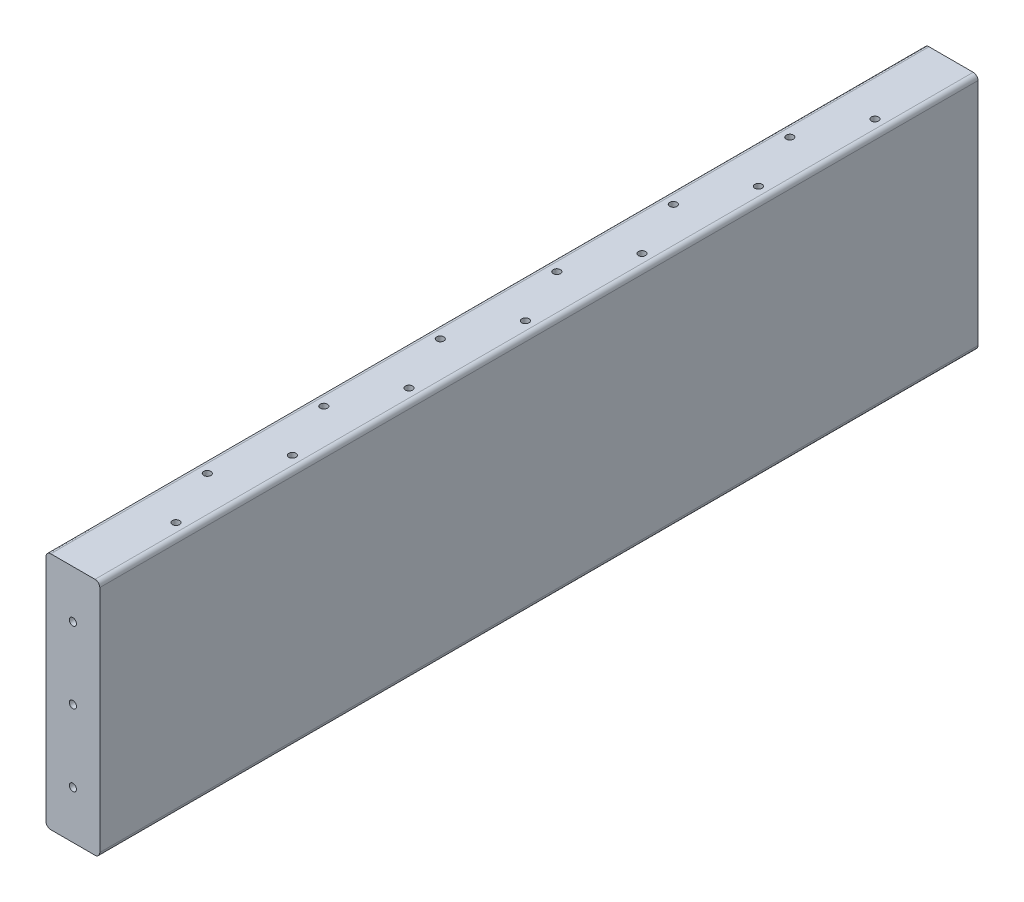
from build123d import *

# Parameters (mm, degrees)
SKETCH1_W                       = 45
SKETCH1_H                       = 200
BOSS_EXTRUDE1_DEPTH             = 735
FILLET1_R                       = 4
F_6_0MM_DOWEL_SLOT1_D           = 6
F_6_0MM_DOWEL_SLOT1_DEPTH       = 63.197418143
F_6_0MM_DOWEL_SLOT1_CSINK_D     = 6.05
F_6_0MM_DOWEL_SLOT1_CSINK_ANGLE = 90
F_6_0MM_DOWEL_SLOT1_TIP         = 1.802581857
F_6_0MM_DOWEL_SLOT2_D           = 6
F_6_0MM_DOWEL_SLOT2_DEPTH       = 63.197418143
F_6_0MM_DOWEL_SLOT2_CSINK_D     = 6.05
F_6_0MM_DOWEL_SLOT2_CSINK_ANGLE = 90
F_6_0MM_DOWEL_SLOT2_TIP         = 1.802581857
F_6_0MM_DOWEL_SLOT6_D           = 6
F_6_0MM_DOWEL_SLOT6_DEPTH       = 28.197418143
F_6_0MM_DOWEL_SLOT6_CSINK_D     = 6.05
F_6_0MM_DOWEL_SLOT6_CSINK_ANGLE = 90
F_6_0MM_DOWEL_SLOT6_TIP         = 1.802581857


with BuildPart() as part:
    # Sketch1 → Boss-Extrude1 (new body)
    with BuildSketch(Plane.XY):
        with Locations((-8.688255411, 34.272684877)):
            Rectangle(SKETCH1_W, SKETCH1_H)
    extrude(amount=BOSS_EXTRUDE1_DEPTH)

    # Fillet1
    fillet1_edges = [part.edges().sort_by_distance(p)[0] for p in [
        (13.811744589, 134.272684877, 367.5),
        (13.811744589, -65.727315123, 367.5),
        (-31.188255411, -65.727315123, 367.5),
        (-31.188255411, 134.272684877, 367.5),
    ]]
    fillet(fillet1_edges, radius=FILLET1_R)

    # Ø6.0mm Dowel Slot1
    with Locations(Plane(origin=(863.811744589, -65.727315123, 780), x_dir=(1, 0, 0), z_dir=(0, 0, 1))):
        with Locations((-872.5, 160), (-872.5, 100), (-872.5, 40)):
            CounterSinkHole(F_6_0MM_DOWEL_SLOT1_D / 2, F_6_0MM_DOWEL_SLOT1_CSINK_D / 2, depth=F_6_0MM_DOWEL_SLOT1_DEPTH, counter_sink_angle=F_6_0MM_DOWEL_SLOT1_CSINK_ANGLE)
            with Locations((0, 0, -(F_6_0MM_DOWEL_SLOT1_DEPTH + F_6_0MM_DOWEL_SLOT1_TIP / 2))):  # 118° drill point
                Cone(0, F_6_0MM_DOWEL_SLOT1_D / 2, F_6_0MM_DOWEL_SLOT1_TIP, mode=Mode.SUBTRACT)

    # Ø6.0mm Dowel Slot2
    with Locations(Plane(origin=(863.811744589, -65.727315123, -45), x_dir=(-1, 0, 0), z_dir=(0, 0, -1))):
        with Locations((872.5, 160), (872.5, 100), (872.5, 40)):
            CounterSinkHole(F_6_0MM_DOWEL_SLOT2_D / 2, F_6_0MM_DOWEL_SLOT2_CSINK_D / 2, depth=F_6_0MM_DOWEL_SLOT2_DEPTH, counter_sink_angle=F_6_0MM_DOWEL_SLOT2_CSINK_ANGLE)
            with Locations((0, 0, -(F_6_0MM_DOWEL_SLOT2_DEPTH + F_6_0MM_DOWEL_SLOT2_TIP / 2))):  # 118° drill point
                Cone(0, F_6_0MM_DOWEL_SLOT2_D / 2, F_6_0MM_DOWEL_SLOT2_TIP, mode=Mode.SUBTRACT)

    # Ø6.0mm Dowel Slot6
    with Locations(Plane(origin=(863.811744589, 146.272684877, -45), x_dir=(0, 0, 1), z_dir=(0, 1, 0))):
        with Locations((22.5, 1726.5), (22.5, 1640.5), (802.5, 1726.5), (802.5, 1640.5), (22.5, -955.960621131), (22.5, -1636.5), (802.5, -1462.5), (802.5, -1636.5), (22.5, -1722.5), (802.5, -1722.5), (22.5, -1550.5), (802.5, -640.31), (120, -1722.5), (217.5, -1722.5), (315, -1722.5), (412.5, -1722.5), (510, -1722.5), (607.5, -1722.5), (705, -1722.5), (22.5, -861.25), (22.5, -883.75), (-22.496198074, -917.60220409), (802.5, -861.25), (802.5, -883.75), (847.496198074, -917.60220409), (802.5, -529.84), (22.5, -750.249617159), (-341.005231297, -650.318686522), (1166.005231297, -650.318686522), (-310.084924074, 22.5), (-310.084924074, 67.5), (22.5, 67.5), (22.5, 22.5), (802.5, 67.5), (802.5, 22.5), (1133.730020848, 67.5), (1133.730020848, 22.5), (1166.005231297, 740.318686522), (802.560751791, 973.75), (802.560751791, 951.25), (847.496198074, 1007.60220409), (-22.496198074, 1007.60220409), (22.560751791, 951.25), (-341.005231297, 740.318686522), (22.5, 1812.5), (802.5, 1812.5), (22.5, 1552.5), (802.5, 1552.5), (-102.162023695, -850.748960129), (-181.827849315, -783.895716167), (-261.493674936, -717.042472206), (927.162023695, -850.748960129), (1006.827849315, -783.895716167), (1086.493674936, -717.042472206), (1086.493674936, 807.042472206), (1006.827849315, 873.895716167), (927.162023695, 940.748960129), (-102.162023695, 940.748960129), (-181.827849315, 873.895716167), (-261.493674936, 807.042472206), (-199.224924074, 67.5), (-88.364924074, 67.5), (-199.224924074, 22.5), (-88.364924074, 22.5), (912.010020848, 67.5), (1022.870020848, 67.5), (912.010020848, 22.5), (1022.870020848, 22.5), (120, 67.5), (217.5, 67.5), (315, 67.5), (607.5, 67.5), (705, 67.5), (510, 67.5), (120, 22.5), (217.5, 22.5), (315, 22.5), (510, 22.5), (607.5, 22.5), (705, 22.5), (412.5, 22.5), (22.5, -750.78), (22.5, -640.31), (22.5, -529.84), (22.5, -419.37), (22.5, -308.9), (22.5, -198.43), (22.5, -87.96), (802.5, -750.78), (802.5, -419.37), (802.5, -308.9), (802.5, -198.43), (22.5, 177.97), (22.5, 288.44), (22.5, 398.91), (22.5, 509.38), (22.5, 619.85), (22.5, 730.32), (22.5, 840.79), (802.5, -87.96), (802.5, 177.97), (802.5, 288.44), (120.000330201, 1812.753749877), (217.5, 1812.5), (315, 1812.5), (412.5, 1812.5), (510, 1812.5), (607.5, 1812.5), (705, 1812.5), (120.060751791, 951.25), (217.560751791, 951.25), (315.060751791, 951.25), (412.560751791, 951.25), (510.060751791, 951.25), (607.560751791, 951.25), (705.060751791, 951.25), (656.310751791, 973.75), (558.810751791, 973.75), (461.310751791, 973.75), (363.810751791, 973.75), (266.310751791, 973.75), (168.810751791, 973.75), (120, -861.25), (217.5, -861.25), (315, -861.25), (412.5, -861.25), (510, -861.25), (607.5, -861.25), (705, -861.25), (656.25, -883.75), (558.75, -883.75), (461.25, -883.75), (168.75, -883.75), (266.25, -883.75), (363.75, -883.75), (802.560751791, -955.960621131), (412.5, 67.5), (802.5, 730.32), (802.560751791, 840.79), (802.5, 398.91), (802.5, 509.38), (802.5, 619.85), (-360.000025903, 699.425529794), (-360.000025903, -609.521258848), (-360.000025903, 598.725529794), (-360.000025903, 498.025529794), (-360.000025903, 397.325529794), (-360.000025903, 296.625529794), (-360.000025903, 195.925529794), (-360.000025903, 95.225529794), (-360.000025903, -5.474470206), (-360.000025903, -106.174470206), (-360.000025903, -206.874470206), (-360.000025903, -307.574470206), (-360.000025903, -408.274470206), (-360.000025903, -508.974470206), (1185.00101945, 699.425529452), (1185.000941829, 598.725529794), (1185.000864209, 498.025529794), (1185.000708968, 296.625529794), (1185.000631348, 195.925529794), (1185.000553727, 95.225529794), (1185.000476107, -5.474470206), (1185.000398486, -106.174470206), (1185.000320866, -206.874470206), (1185.000165625, -408.274470206), (1185.000088004, -508.974470206), (1185.000786589, 397.325529794), (22.560751791, 1016.385842825), (802.560751791, 1016.385842825), (802.560751791, -1550.5), (22.560751791, 973.75), (802.560751791, -363.966698641)):
            CounterSinkHole(F_6_0MM_DOWEL_SLOT6_D / 2, F_6_0MM_DOWEL_SLOT6_CSINK_D / 2, depth=F_6_0MM_DOWEL_SLOT6_DEPTH, counter_sink_angle=F_6_0MM_DOWEL_SLOT6_CSINK_ANGLE)
            with Locations((0, 0, -(F_6_0MM_DOWEL_SLOT6_DEPTH + F_6_0MM_DOWEL_SLOT6_TIP / 2))):  # 118° drill point
                Cone(0, F_6_0MM_DOWEL_SLOT6_D / 2, F_6_0MM_DOWEL_SLOT6_TIP, mode=Mode.SUBTRACT)


solid = part.part
